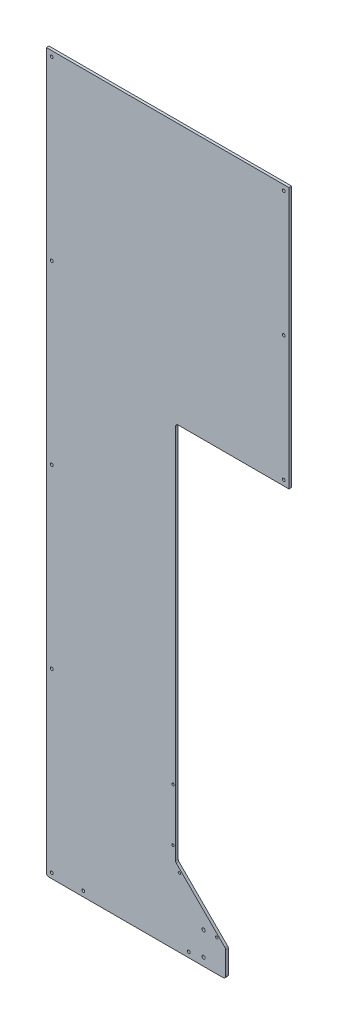
from build123d import *

# Parameters (mm, degrees)
SKETCH2_W                                       = 584.2
SKETCH2_H                                       = 1727.2
BOSS_EXTRUDE1_DEPTH                             = 6.35
CUT_EXTRUDE1_DEPTH                              = 1824.334802635
H_0_266_DIAMETER_HOLE1_D                        = 6.7564
FILLET1_R                                       = 6.35
SKETCH7_R                                       = 3.3782
CUT_EXTRUDE2_DEPTH                              = 12.7
CSK_FOR_10_FLAT_HEAD_MACHINE_SCREW1_D           = 5.6134
CSK_FOR_10_FLAT_HEAD_MACHINE_SCREW1_CSINK_D     = 9.779
CSK_FOR_10_FLAT_HEAD_MACHINE_SCREW1_CSINK_ANGLE = 82
SKETCH15_R                                      = 3.937
CUT_EXTRUDE3_DEPTH                              = 1824.334802635


with BuildPart() as part:
    # Sketch2 → Boss-Extrude1 (new body)
    with BuildSketch(Plane.XY):
        with Locations((292.1, 863.6)):
            Rectangle(SKETCH2_W, SKETCH2_H)
    extrude(amount=BOSS_EXTRUDE1_DEPTH)

    # Sketch3 → Cut-Extrude1 (cut, through all)
    with BuildSketch(Plane.XY.offset(6.35)):
        Polygon((584.2, 1098.55), (311.15, 1098.55), (311.15, 184.15), (431.8, 63.5), (431.8, 0), (584.2, 0), align=None)
    extrude(amount=-CUT_EXTRUDE1_DEPTH, mode=Mode.SUBTRACT)

    # H (0.266) Diameter Hole1 (through all)
    with Locations(Plane.XY.offset(6.35)):
        with Locations((12.7, 1714.5), (12.7, 1289.05), (12.7, 863.6), (12.7, 438.15), (12.7, 12.7), (571.5, 1111.25), (571.5, 1412.875), (571.5, 1714.5)):
            Hole(H_0_266_DIAMETER_HOLE1_D / 2)

    # Fillet1
    fillet1_edges = [part.edges().sort_by_distance(p)[0] for p in [
        (431.8, 0, 3.175),
        (431.8, 63.5, 3.175),
        (311.15, 184.15, 3.175),
        (311.15, 1098.55, 3.175),
        (0, 0, 3.175),
    ]]
    fillet(fillet1_edges, radius=FILLET1_R)

    # Sketch7 → Cut-Extrude2 (cut)
    with BuildSketch(Plane.XY.offset(6.35)):
        with Locations((88.9, 12.7)):
            Circle(SKETCH7_R)
        with Locations((342.9, 12.7)):
            Circle(SKETCH7_R)
    extrude(amount=-CUT_EXTRUDE2_DEPTH, mode=Mode.SUBTRACT)

    # CSK for #10 Flat Head Machine Screw1 (through all)
    with Locations(Plane(origin=(0, 0, 0), x_dir=(-1, 0, 0), z_dir=(0, 0, -1))):
        with Locations((-304.8, 342.9), (-304.8, 215.9), (-320.317182668, 166.002561211), (-410.119743879, 76.2)):
            CounterSinkHole(CSK_FOR_10_FLAT_HEAD_MACHINE_SCREW1_D / 2, CSK_FOR_10_FLAT_HEAD_MACHINE_SCREW1_CSINK_D / 2, counter_sink_angle=CSK_FOR_10_FLAT_HEAD_MACHINE_SCREW1_CSINK_ANGLE)

    # Sketch15 → Cut-Extrude3 (cut, through all)
    with BuildSketch(Plane.XY.offset(6.35)):
        with Locations((378.46762, 19.05)):
            Circle(SKETCH15_R)
        with Locations((378.46762, 76.2)):
            Circle(SKETCH15_R)
    extrude(amount=-CUT_EXTRUDE3_DEPTH, mode=Mode.SUBTRACT)


solid = part.part
